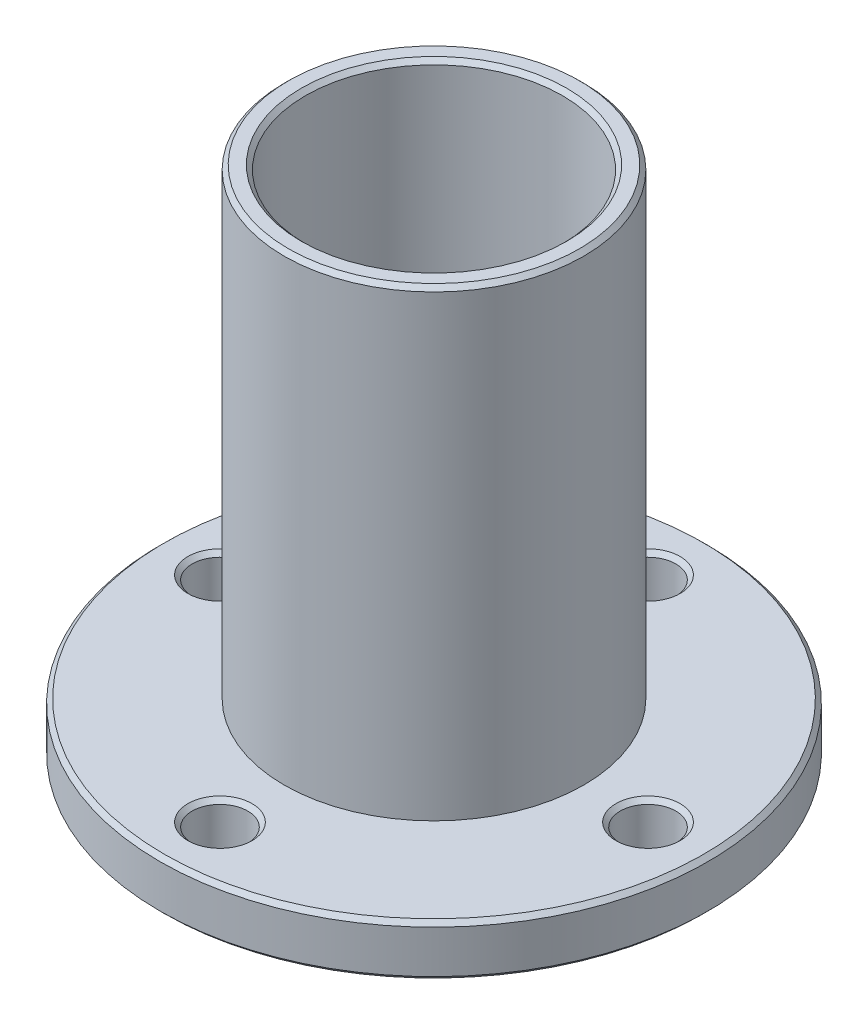
from build123d import *

# Parameters (mm, degrees)
SKETCH1_R           = 32
BOSS_EXTRUDE1_DEPTH = 60
SKETCH2_OUTSIDE_W   = 87.718
SKETCH2_OUTSIDE_H   = 87.718
SKETCH2_OUTSIDE_R   = 17.5
CUT_EXTRUDE1_DEPTH  = 54
SKETCH4_R           = 20
CUT_EXTRUDE2_DEPTH  = 2.3
SKETCH5_R           = 15
CUT_EXTRUDE3_DEPTH  = 74.3300075
CHAMFER1_SIZE       = 0.5
SKETCH6_R           = 3.25
CUT_EXTRUDE4_DEPTH  = 76.153176912
CHAMFER2_SIZE       = 0.5


with BuildPart() as part:
    # Sketch1 → Boss-Extrude1 (new body)
    with BuildSketch(Plane(origin=(0, 0, 0), x_dir=(1, 0, 0), z_dir=(0, 1, 0))):
        with Locations(Location((0, 0, 0), (0, 0, 270))):
            Circle(SKETCH1_R)
    extrude(amount=BOSS_EXTRUDE1_DEPTH)

    # Sketch2 outside → Cut-Extrude1 (cut)
    with BuildSketch(Plane(origin=(0, 60, 0), x_dir=(1, 0, 0), z_dir=(0, 1, 0))):
        Rectangle(SKETCH2_OUTSIDE_W, SKETCH2_OUTSIDE_H)
        with Locations(Location((0, 0, 0), (0, 0, 270))):
            Circle(SKETCH2_OUTSIDE_R, mode=Mode.SUBTRACT)
    extrude(amount=-CUT_EXTRUDE1_DEPTH, mode=Mode.SUBTRACT)

    # Sketch4 → Cut-Extrude2 (cut)
    with BuildSketch(Plane.XZ):
        with Locations(Location((0, 0, 0), (0, 0, 270))):
            Circle(SKETCH4_R)
    extrude(amount=-CUT_EXTRUDE2_DEPTH, mode=Mode.SUBTRACT)

    # Sketch5 → Cut-Extrude3 (cut, through all)
    with BuildSketch(Plane.XZ.offset(-2.3)):
        with Locations(Location((0, 0, 0), (0, 0, 270))):
            Circle(SKETCH5_R)
    extrude(amount=-CUT_EXTRUDE3_DEPTH, mode=Mode.SUBTRACT)

    # Chamfer1
    chamfer1_edges = [part.edges().sort_by_distance(p)[0] for p in [
        (0, 60, -17.5),
        (0, 0, -32),
        (0, 60, 15),
        (0, 2.3, 15),
        (0, 6, -32),
    ]]
    chamfer(chamfer1_edges, length=CHAMFER1_SIZE)

    # Sketch6 → Cut-Extrude4 (cut, through all)
    with BuildSketch(Plane.XZ):
        with Locations(Location((25, 0, 0), (0, 0, 270))):
            Circle(SKETCH6_R)
        with Locations(Location((0, -25, 0), (0, 0, 270))):
            Circle(SKETCH6_R)
        with Locations(Location((-25, 0, 0), (0, 0, 270))):
            Circle(SKETCH6_R)
        with Locations(Location((0, 25, 0), (0, 0, 270))):
            Circle(SKETCH6_R)
    extrude(amount=-CUT_EXTRUDE4_DEPTH, mode=Mode.SUBTRACT)

    # Chamfer2
    chamfer2_edges = [part.edges().sort_by_distance(p)[0] for p in [
        (25, 6, 3.25),
        (25, 0, 3.25),
        (0, 6, -21.75),
        (0, 0, -21.75),
        (-25, 6, 3.25),
        (-25, 0, 3.25),
        (0, 6, 28.25),
        (0, 0, 28.25),
    ]]
    chamfer(chamfer2_edges, length=CHAMFER2_SIZE)


solid = part.part
